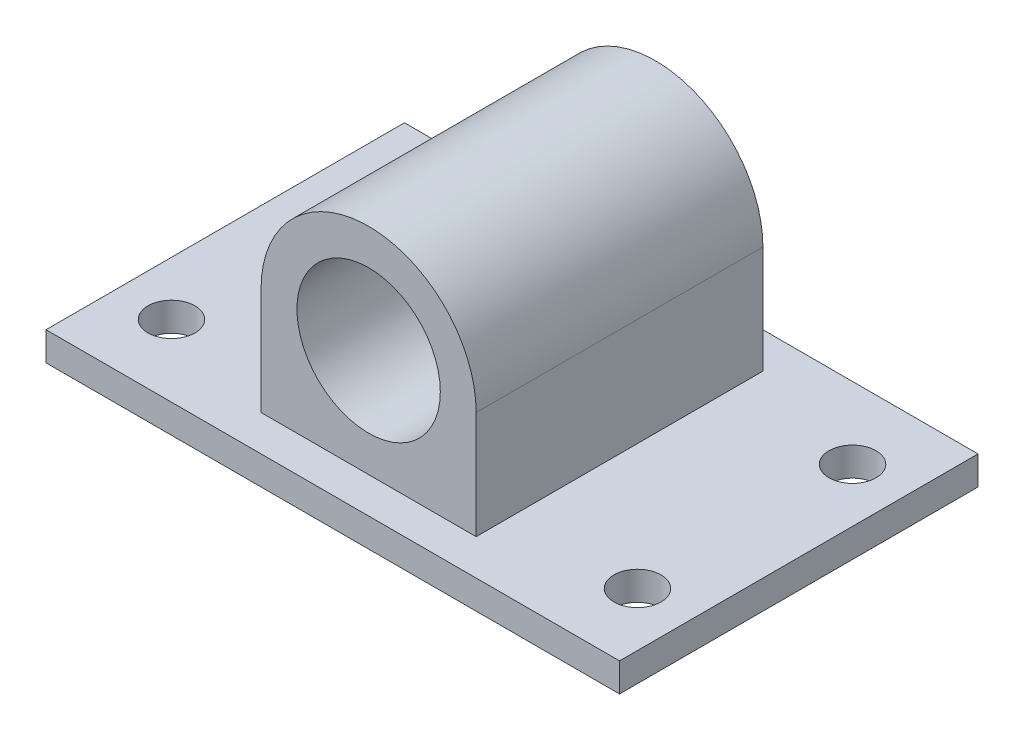
from build123d import *

# Parameters (mm, degrees)
SKETCH1_W           = 101.6
SKETCH1_H           = 63.5
BOSS_EXTRUDE1_DEPTH = 5.08
SKETCH2_R           = 4.1656
CUT_EXTRUDE1_DEPTH  = 61.120785923
SKETCH3_R           = 12.7
BOSS_EXTRUDE2_DEPTH = 25.4


with BuildPart() as part:
    # Sketch1 → Boss-Extrude1 (new body)
    with BuildSketch(Plane(origin=(0, 0, 0), x_dir=(1, 0, 0), z_dir=(0, 1, 0))):
        Rectangle(SKETCH1_W, SKETCH1_H)
    extrude(amount=BOSS_EXTRUDE1_DEPTH)

    # Sketch2 → Cut-Extrude1 (cut, through all)
    with BuildSketch(Plane(origin=(0, 0, 0), x_dir=(1, 0, 0), z_dir=(0, 1, 0))):
        with Locations(Location((-41.275, 19.05, 0), (0, 0, 270))):
            Circle(SKETCH2_R)
        with Locations(Location((41.275, 19.05, 0), (0, 0, 270))):
            Circle(SKETCH2_R)
        with Locations(Location((41.275, -19.05, 0), (0, 0, 270))):
            Circle(SKETCH2_R)
        with Locations(Location((-41.275, -19.05, 0), (0, 0, 270))):
            Circle(SKETCH2_R)
    extrude(amount=CUT_EXTRUDE1_DEPTH, mode=Mode.SUBTRACT)

    # Sketch3 → Boss-Extrude2 (add, symmetric)
    with BuildSketch(Plane.XY):
        with BuildLine():
            Line((-19.05, 24.13), (-19.05, 5.08))
            Line((-19.05, 5.08), (19.05, 5.08))
            Line((19.05, 5.08), (19.05, 24.13))
            ThreePointArc((19.05, 24.13), (0, 43.18), (-19.05, 24.13))
        make_face()
        with Locations((0, 24.13)):
            Circle(SKETCH3_R, mode=Mode.SUBTRACT)
    extrude(amount=BOSS_EXTRUDE2_DEPTH, both=True)


solid = part.part
